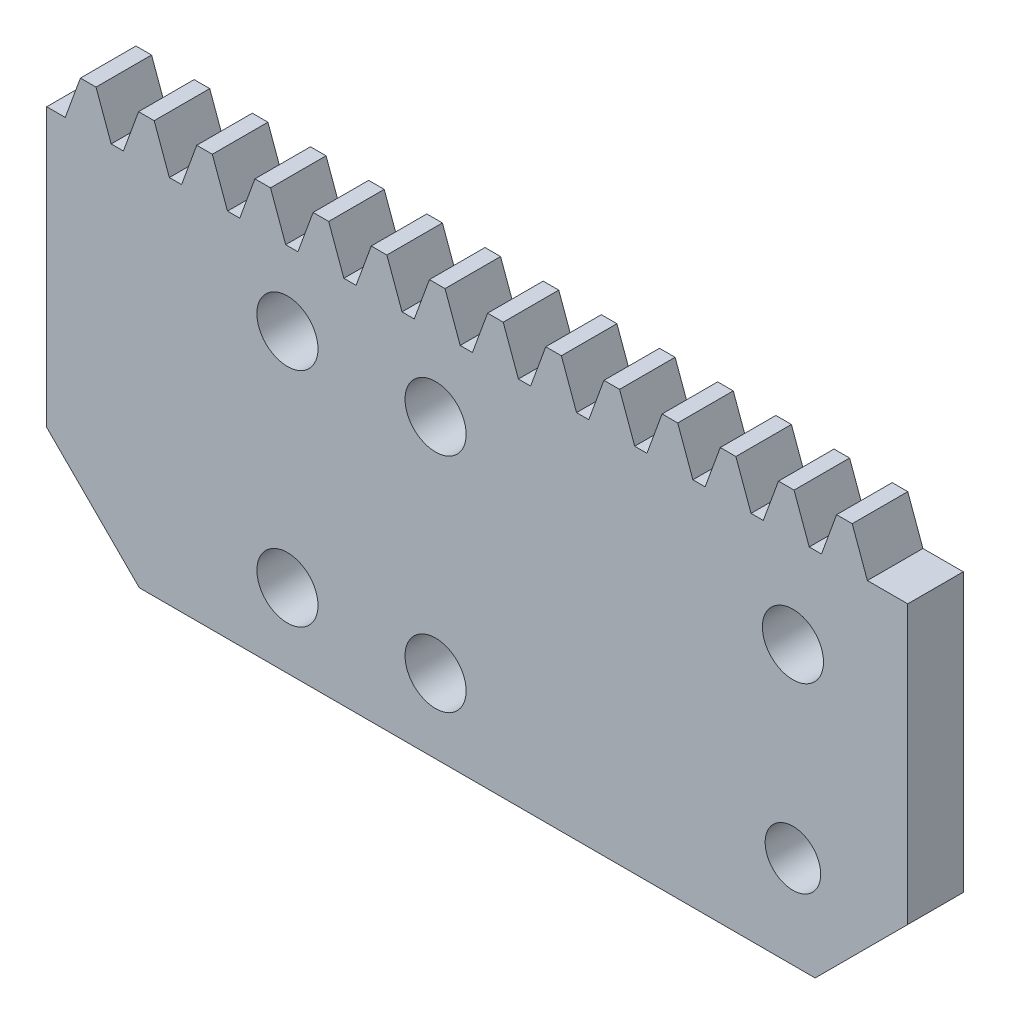
from build123d import *

# Parameters (mm, degrees)
SKETCH_1_W             = 46.5
SKETCH_1_H             = 20
EXTRUDE_1_DEPTH        = 3
EXTRUDE_2_DEPTH        = 3
PATTERN_LINEAR_1_COUNT = 14
PATTERN_LINEAR_1_PITCH = 3.141592654
SKETCH_3_R             = 1.65
CUT_EXTRUDE_1_DEPTH    = 3
SKETCH_4_R             = 1.65
SKETCH_4_R_2           = 1.5
CUT_EXTRUDE_2_DEPTH    = 10
CHAMFER_1_SIZE         = 5


with BuildPart() as part:
    # 草圖1 → 填料-伸長1 (new body)
    with BuildSketch(Plane.XY):
        Rectangle(SKETCH_1_W, SKETCH_1_H)
    extrude(amount=EXTRUDE_1_DEPTH)

    # 草圖2 → 填料-伸長2 (add)
    with BuildSketch(Plane.XY.offset(3)):
        Polygon((-22.25, 10), (-21.431066973, 12.25), (-20.588211115, 12.25), (-19.769278088, 10), align=None)
    extrude_2 = extrude(amount=-EXTRUDE_2_DEPTH)

    # 直線複製排列1: 填料-伸長2 ×14
    with Locations(*[(i * PATTERN_LINEAR_1_PITCH, 0, 0) for i in range(1, PATTERN_LINEAR_1_COUNT)]):
        add(extrude_2)

    # 草圖3 → 除料-伸長1 (cut)
    with BuildSketch(Plane.XY.offset(3)):
        with Locations((-10.25, 6)):
            Circle(SKETCH_3_R)
        with Locations((-2.25, 6)):
            Circle(SKETCH_3_R)
        with Locations((-2.25, -6)):
            Circle(SKETCH_3_R)
        with Locations((-10.25, -6)):
            Circle(SKETCH_3_R)
    extrude(amount=-CUT_EXTRUDE_1_DEPTH, mode=Mode.SUBTRACT)

    # 草圖4 → 除料-伸長2 (cut)
    with BuildSketch(Plane.XY.offset(3)):
        with Locations((17.05, 5)):
            Circle(SKETCH_4_R)
        with Locations((17.05, -5)):
            Circle(SKETCH_4_R_2)
    extrude(amount=-CUT_EXTRUDE_2_DEPTH, mode=Mode.SUBTRACT)

    # 導角1
    chamfer_1_edges = [part.edges().sort_by_distance(p)[0] for p in [
        (23.25, -10, 1.5),
        (-23.25, -10, 1.5),
    ]]
    chamfer(chamfer_1_edges, length=CHAMFER_1_SIZE)


solid = part.part
